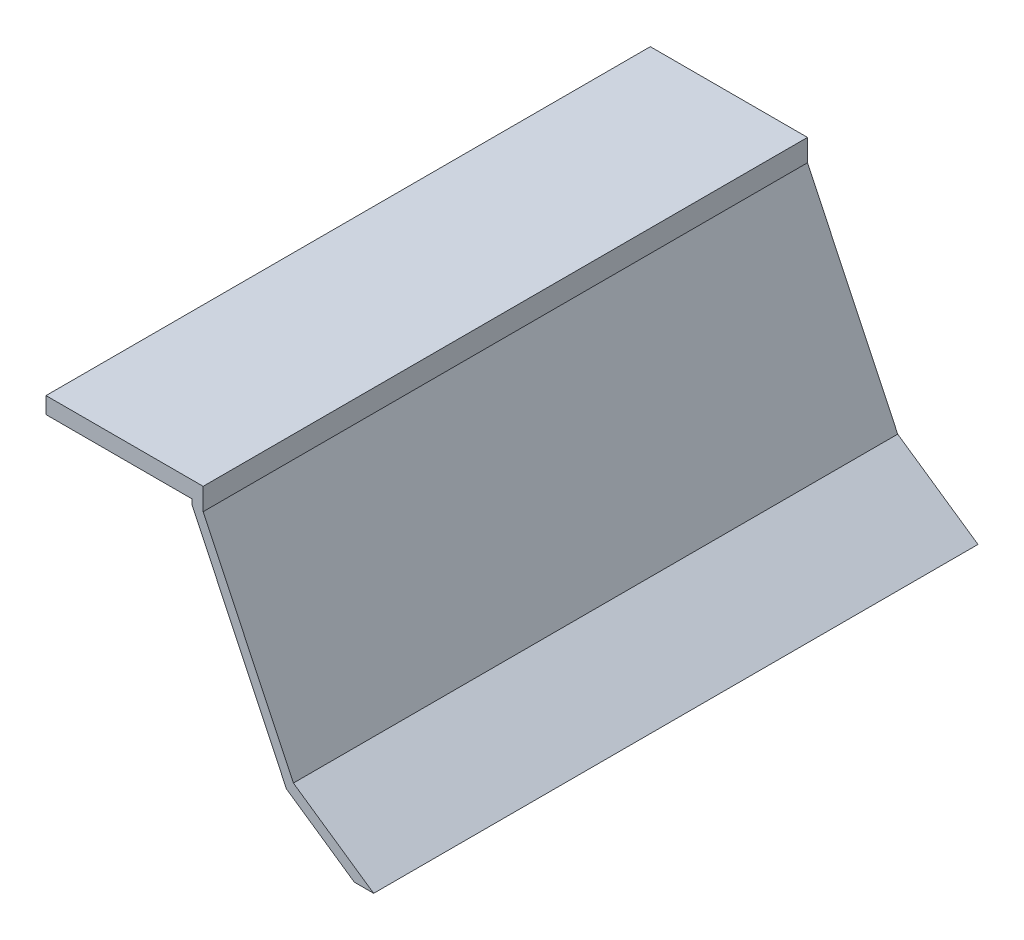
from build123d import *

# Parameters (mm, degrees)
BOSS_EXTRUDE1_DEPTH = 110


with BuildPart() as part:
    # Sketch1 → Boss-Extrude1 (new body)
    with BuildSketch(Plane.XY):
        Polygon((0, 0), (28.60723722, 0), (28.60723722, -3.999262629), (45.03125979, -38.567818362), (59.645134873, -48.644335709), (56.121873956, -48.644335709), (43.772885567, -40.129496557), (26.607237356, -4), (26.607237356, -3), (0, -3), align=None)
    extrude(amount=BOSS_EXTRUDE1_DEPTH)


solid = part.part
